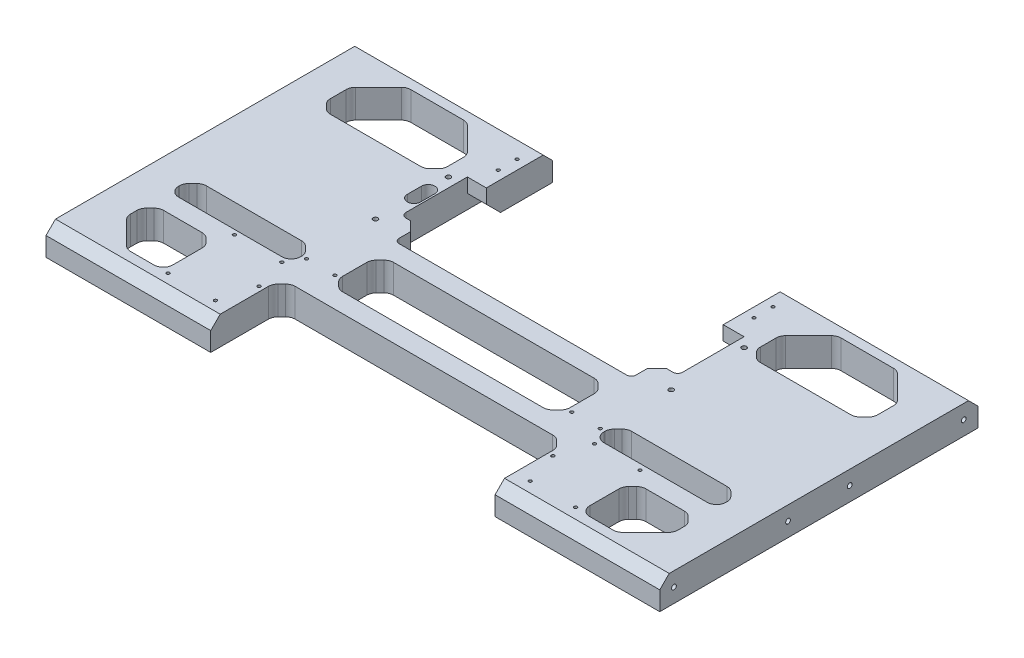
from build123d import *

# Parameters (mm, degrees)
SKETCH1_W                  = 647.636
SKETCH1_H                  = 335.8
BOSS_EXTRUDE1_DEPTH        = 30
M6_TAPPED_HOLE1_AT_2_COUNT = 2
M6_TAPPED_HOLE1_AT_2_PITCH = 120.4
M6_TAPPED_HOLE1_AT_3_COUNT = 2
M6_TAPPED_HOLE1_AT_3_PITCH = 185.4
M6_TAPPED_HOLE1_AT_4_COUNT = 2
M6_TAPPED_HOLE1_AT_4_PITCH = 305.8
SKETCH5_W                  = 250
SKETCH5_H                  = 85
CUT_EXTRUDE2_DEPTH         = 366.989763687
SKETCH8_W                  = 300
SKETCH8_H                  = 75
CUT_EXTRUDE5_DEPTH         = 366.989763687
SKETCH9_W                  = 250
SKETCH9_H                  = 82
CUT_EXTRUDE6_DEPTH         = 366.989763687
CUT_EXTRUDE7_DEPTH         = 366.989763687
CUT_EXTRUDE11_START        = -30
SKETCH14_W                 = 292
SKETCH14_H                 = 70
CUT_EXTRUDE11_DEPTH        = 30
SKETCH15_W                 = 240
SKETCH15_H                 = 53.8
CUT_EXTRUDE12_DEPTH        = 366.989763687
SKETCH16_W                 = 68.818
SKETCH16_H                 = 55
SKETCH16_W_2               = 123.818
SKETCH16_H_2               = 65
SKETCH16_W_3               = 128.818
SKETCH16_H_3               = 25
CUT_EXTRUDE13_DEPTH        = 366.989763687
CHAMFER1_SIZE              = 30
CHAMFER2_SIZE              = 10
FILLET1_R                  = 5
FILLET2_R                  = 10
CHAMFER4_SIZE              = 15
CHAMFER5_SIZE              = 10
M6_TAPPED_HOLE2_D          = 5
M6_TAPPED_HOLE2_DEPTH      = 15
M6_TAPPED_HOLE2_TIP        = 1.502151548
M4_TAPPED_HOLE2_D          = 3.3
M4_TAPPED_HOLE2_DEPTH      = 10.1
M4_TAPPED_HOLE2_TIP        = 0.991420021
M4_TAPPED_HOLE1_D          = 3.3
M4_TAPPED_HOLE1_DEPTH      = 10.1
M4_TAPPED_HOLE1_TIP        = 0.991420021
M6_TAPPED_HOLE3_D          = 5
M6_TAPPED_HOLE3_DEPTH      = 15
M6_TAPPED_HOLE3_TIP        = 1.502151548


with BuildPart() as part:
    # Sketch1 → Boss-Extrude1 (new body)
    with BuildSketch(Plane(origin=(0, 0, 0), x_dir=(1, 0, 0), z_dir=(0, 1, 0))):
        Rectangle(SKETCH1_W, SKETCH1_H)
    extrude(amount=BOSS_EXTRUDE1_DEPTH)

    # Sketch4 → M6 Tapped Hole1 (revolve, cut)
    with BuildSketch(Plane(origin=(-323.818, 15, -152.9), x_dir=(0, 0, 1), z_dir=(0, 1, 0))):
        Polygon((0, 0), (0, 26.502151548), (2.5, 25), (2.5, 0), align=None)
    m6_tapped_hole1 = revolve(axis=Axis((-330.168, 15, -152.9), (1, 0, 0)), mode=Mode.SUBTRACT)

    # M6 Tapped Hole1 at 2: M6 Tapped Hole1 ×2
    with Locations(*[(0, 0, i * M6_TAPPED_HOLE1_AT_2_PITCH) for i in range(1, M6_TAPPED_HOLE1_AT_2_COUNT)]):
        add(m6_tapped_hole1, mode=Mode.SUBTRACT)

    # M6 Tapped Hole1 at 3: M6 Tapped Hole1 ×2
    with Locations(*[(0, 0, i * M6_TAPPED_HOLE1_AT_3_PITCH) for i in range(1, M6_TAPPED_HOLE1_AT_3_COUNT)]):
        add(m6_tapped_hole1, mode=Mode.SUBTRACT)

    # M6 Tapped Hole1 at 4: M6 Tapped Hole1 ×2
    with Locations(*[(0, 0, i * M6_TAPPED_HOLE1_AT_4_PITCH) for i in range(1, M6_TAPPED_HOLE1_AT_4_COUNT)]):
        add(m6_tapped_hole1, mode=Mode.SUBTRACT)

    # Mirror1: M6 Tapped Hole1 across plane
    add(m6_tapped_hole1.mirror(Plane(origin=(0, 0, 0), x_dir=(0, 0, 1), z_dir=(1, 0, 0))), mode=Mode.SUBTRACT)

    # Mirror1 copy 1 sketch → Mirror1 copy 1 (revolve, cut)
    with BuildSketch(Plane(origin=(323.818, 15, -32.5), x_dir=(0, 0, 1), z_dir=(0, 1, 0))):
        Polygon((0, 0), (0, -26.502151548), (2.5, -25), (2.5, 0), align=None)
    revolve(axis=Axis((330.168, 15, -32.5), (1, 0, 0)), mode=Mode.SUBTRACT)

    # Mirror1 copy 2 sketch → Mirror1 copy 2 (revolve, cut)
    with BuildSketch(Plane(origin=(323.818, 15, 32.5), x_dir=(0, 0, 1), z_dir=(0, 1, 0))):
        Polygon((0, 0), (0, -26.502151548), (2.5, -25), (2.5, 0), align=None)
    revolve(axis=Axis((330.168, 15, 32.5), (1, 0, 0)), mode=Mode.SUBTRACT)

    # Mirror1 copy 3 sketch → Mirror1 copy 3 (revolve, cut)
    with BuildSketch(Plane(origin=(323.818, 15, 152.9), x_dir=(0, 0, 1), z_dir=(0, 1, 0))):
        Polygon((0, 0), (0, -26.502151548), (2.5, -25), (2.5, 0), align=None)
    revolve(axis=Axis((330.168, 15, 152.9), (1, 0, 0)), mode=Mode.SUBTRACT)

    # Sketch5 → Cut-Extrude2 (cut, through all)
    with BuildSketch(Plane(origin=(0, 30, 0), x_dir=(1, 0, 0), z_dir=(0, 1, 0))):
        with Locations((0, 125.4)):
            Rectangle(SKETCH5_W, SKETCH5_H)
    extrude(amount=-CUT_EXTRUDE2_DEPTH, mode=Mode.SUBTRACT)

    # Sketch8 → Cut-Extrude5 (cut, through all)
    with BuildSketch(Plane(origin=(0, 30, 0), x_dir=(1, 0, 0), z_dir=(0, 1, 0))):
        with Locations((0, -130.4)):
            Rectangle(SKETCH8_W, SKETCH8_H)
    extrude(amount=-CUT_EXTRUDE5_DEPTH, mode=Mode.SUBTRACT)

    # Sketch9 → Cut-Extrude6 (cut, through all)
    with BuildSketch(Plane.XZ):
        with Locations((0, -41.9)):
            Rectangle(SKETCH9_W, SKETCH9_H)
    extrude(amount=-CUT_EXTRUDE6_DEPTH, mode=Mode.SUBTRACT)

    # Sketch10 → Cut-Extrude7 (cut, through all)
    with BuildSketch(Plane(origin=(0, 30, 0), x_dir=(1, 0, 0), z_dir=(0, 1, 0))):
        with BuildLine():
            Line((-146.818, 65.4), (-146.818, 50.4))
            ThreePointArc((-146.818, 50.4), (-153.818, 43.4), (-160.818, 50.4))
            Line((-160.818, 50.4), (-160.818, 65.4))
            ThreePointArc((-160.818, 65.4), (-153.818, 72.4), (-146.818, 65.4))
        make_face()
    extrude(amount=-CUT_EXTRUDE7_DEPTH, mode=Mode.SUBTRACT)

    # Sketch14 → Cut-Extrude11 (cut)
    with BuildSketch(Plane.XZ.offset(CUT_EXTRUDE11_START)):
        with Locations((1, -62.9)):
            Rectangle(SKETCH14_W, SKETCH14_H)
    extrude(amount=CUT_EXTRUDE11_DEPTH, mode=Mode.SUBTRACT)

    # Sketch15 → Cut-Extrude12 (cut, through all)
    with BuildSketch(Plane(origin=(0, 0, 0), x_dir=(-1, 0, 0), z_dir=(0, -1, 0))):
        with Locations((0, -46)):
            Rectangle(SKETCH15_W, SKETCH15_H)
    extrude(amount=-CUT_EXTRUDE12_DEPTH, mode=Mode.SUBTRACT)

    # Sketch16 → Cut-Extrude13 (cut, through all)
    with BuildSketch(Plane(origin=(0, 30, 0), x_dir=(1, 0, 0), z_dir=(0, 1, 0))):
        with Locations((-254.409, -120.4)):
            Rectangle(SKETCH16_W, SKETCH16_H)
        with Locations((-226.909, 115.4)):
            Rectangle(SKETCH16_W_2, SKETCH16_H_2)
        with Locations((-224.409, -60.4)):
            Rectangle(SKETCH16_W_3, SKETCH16_H_3)
        with Locations((224.409, -60.4)):
            Rectangle(SKETCH16_W_3, SKETCH16_H_3)
        with Locations((226.909, 115.4)):
            Rectangle(SKETCH16_W_2, SKETCH16_H_2)
        with Locations((254.409, -120.4)):
            Rectangle(SKETCH16_W, SKETCH16_H)
    extrude(amount=-CUT_EXTRUDE13_DEPTH, mode=Mode.SUBTRACT)

    # Chamfer1
    chamfer1_edges = [part.edges().sort_by_distance(p)[0] for p in [
        (288.818, 15, 147.9),
        (165, 15, -147.9),
        (288.818, 15, -147.9),
        (-288.818, 15, -147.9),
        (-165, 15, -147.9),
        (-288.818, 15, 147.9),
    ]]
    chamfer(chamfer1_edges, length=CHAMFER1_SIZE)

    # Chamfer2
    chamfer2_edges = [part.edges().sort_by_distance(p)[0] for p in [
        (-125, 15, -27.9),
        (125, 15, -27.9),
        (-120, 15, 19.1),
        (-120, 15, 72.9),
        (120, 15, 72.9),
        (120, 15, 19.1),
        (220, 15, 92.9),
        (288.818, 15, 92.9),
        (288.818, 15, -82.9),
        (165, 15, -82.9),
        (160, 15, 47.9),
        (288.818, 15, 47.9),
        (-160, 15, 47.9),
        (-288.818, 15, 47.9),
        (-288.818, 15, -82.9),
        (-165, 15, -82.9),
        (-288.818, 15, 92.9),
        (-220, 15, 92.9),
        (150, 15, 92.9),
        (-150, 15, 92.9),
    ]]
    chamfer(chamfer2_edges, length=CHAMFER2_SIZE)

    # Fillet1
    fillet1_edges = [part.edges().sort_by_distance(p)[0] for p in [
        (-145, 15, -27.9),
        (147, 15, -27.9),
        (-125, 15, -0.9),
        (125, 15, -0.9),
    ]]
    fillet(fillet1_edges, radius=FILLET1_R)

    # Fillet2
    fillet2_edges = [part.edges().sort_by_distance(p)[0] for p in [
        (220, 15, 147.9),
        (288.818, 15, 72.9),
        (160, 15, 72.9),
        (-160, 15, 72.9),
        (-288.818, 15, 72.9),
        (-220, 15, 147.9),
        (-258.818, 15, -147.9),
        (-195, 15, -147.9),
        (-165, 15, -117.9),
        (165, 15, -117.9),
        (258.818, 15, -147.9),
        (195, 15, -147.9),
        (-288.818, 15, -117.9),
        (-258.818, 15, 147.9),
        (-288.818, 15, 117.9),
        (288.818, 15, 117.9),
        (258.818, 15, 147.9),
        (288.818, 15, -117.9),
        (-288.818, 15, 57.9),
        (-170, 15, 47.9),
        (-278.818, 15, 47.9),
        (-160, 15, 57.9),
        (160, 15, 57.9),
        (278.818, 15, 47.9),
        (170, 15, 47.9),
        (-150, 15, 102.9),
        (140, 15, 92.9),
        (-140, 15, 92.9),
        (150, 15, 102.9),
        (-120, 15, 29.1),
        (-120, 15, 62.9),
        (110, 15, 72.9),
        (-110, 15, 72.9),
        (110, 15, 19.1),
        (-110, 15, 19.1),
        (120, 15, 29.1),
        (120, 15, 62.9),
        (288.818, 15, -92.9),
        (175, 15, -82.9),
        (278.818, 15, -82.9),
        (165, 15, -92.9),
        (-175, 15, -82.9),
        (-278.818, 15, -82.9),
        (-288.818, 15, -92.9),
        (-165, 15, -92.9),
        (-288.818, 15, 102.9),
        (-230, 15, 92.9),
        (-278.818, 15, 92.9),
        (-220, 15, 102.9),
        (288.818, 15, 57.9),
        (220, 15, 102.9),
        (278.818, 15, 92.9),
        (230, 15, 92.9),
        (288.818, 15, 102.9),
    ]]
    fillet(fillet2_edges, radius=FILLET2_R)

    # Chamfer4
    chamfer4_edges = [part.edges().sort_by_distance(p)[0] for p in [
        (-135, 0, -97.9),
        (136, 0, -97.9),
    ]]
    chamfer(chamfer4_edges, length=CHAMFER4_SIZE)

    # Chamfer5
    chamfer5_edges = [part.edges().sort_by_distance(p)[0] for p in [
        (-236.909, 30, 167.9),
        (-224.409, 30, -167.9),
        (236.909, 30, 167.9),
        (224.409, 30, -167.9),
    ]]
    chamfer(chamfer5_edges, length=CHAMFER5_SIZE)

    # M6 Tapped Hole2
    with Locations(Plane(origin=(0, 30, 0), x_dir=(1, 0, 0), z_dir=(0, 1, 0))):
        with Locations((-155, 10.9), (-155, 87.9), (157, 87.9), (157, 10.9)):
            Hole(M6_TAPPED_HOLE2_D / 2, depth=M6_TAPPED_HOLE2_DEPTH)
            with Locations((0, 0, -(M6_TAPPED_HOLE2_DEPTH + M6_TAPPED_HOLE2_TIP / 2))):  # 118° drill point
                Cone(0, M6_TAPPED_HOLE2_D / 2, M6_TAPPED_HOLE2_TIP, mode=Mode.SUBTRACT)

    # M4 Tapped Hole2
    with Locations(Plane(origin=(0, 30, 0), x_dir=(1, 0, 0), z_dir=(0, 1, 0))):
        with Locations((-215, -77.9), (-165, -77.9), (-215, -147.9), (-165, -147.9), (-155, -61.9), (-125, -61.9), (-155, -111.9), (155, -111.9), (125, -61.9), (155, -61.9), (166, -78.9), (166, -146.9), (214, -146.9), (214, -78.9)):
            Hole(M4_TAPPED_HOLE2_D / 2, depth=M4_TAPPED_HOLE2_DEPTH)
            with Locations((0, 0, -(M4_TAPPED_HOLE2_DEPTH + M4_TAPPED_HOLE2_TIP / 2))):  # 118° drill point
                Cone(0, M4_TAPPED_HOLE2_D / 2, M4_TAPPED_HOLE2_TIP, mode=Mode.SUBTRACT)

    # M4 Tapped Hole1
    with Locations(Plane(origin=(0, 30, 0), x_dir=(1, 0, 0), z_dir=(0, 1, 0))):
        with Locations((-135, 140.4), (-135, 120.4), (135, 140.4), (135, 120.4)):
            Hole(M4_TAPPED_HOLE1_D / 2, depth=M4_TAPPED_HOLE1_DEPTH)
            with Locations((0, 0, -(M4_TAPPED_HOLE1_DEPTH + M4_TAPPED_HOLE1_TIP / 2))):  # 118° drill point
                Cone(0, M4_TAPPED_HOLE1_D / 2, M4_TAPPED_HOLE1_TIP, mode=Mode.SUBTRACT)

    # M6 Tapped Hole3
    with Locations(Plane(origin=(0, 0, 0), x_dir=(-1, 0, 0), z_dir=(0, -1, 0))):
        with Locations((-260, 32.5), (-180, 32.5), (-180, -32.5), (-260, -32.5), (260, -32.5), (180, -32.5), (180, 32.5), (260, 32.5)):
            Hole(M6_TAPPED_HOLE3_D / 2, depth=M6_TAPPED_HOLE3_DEPTH)
            with Locations((0, 0, -(M6_TAPPED_HOLE3_DEPTH + M6_TAPPED_HOLE3_TIP / 2))):  # 118° drill point
                Cone(0, M6_TAPPED_HOLE3_D / 2, M6_TAPPED_HOLE3_TIP, mode=Mode.SUBTRACT)


solid = part.part
